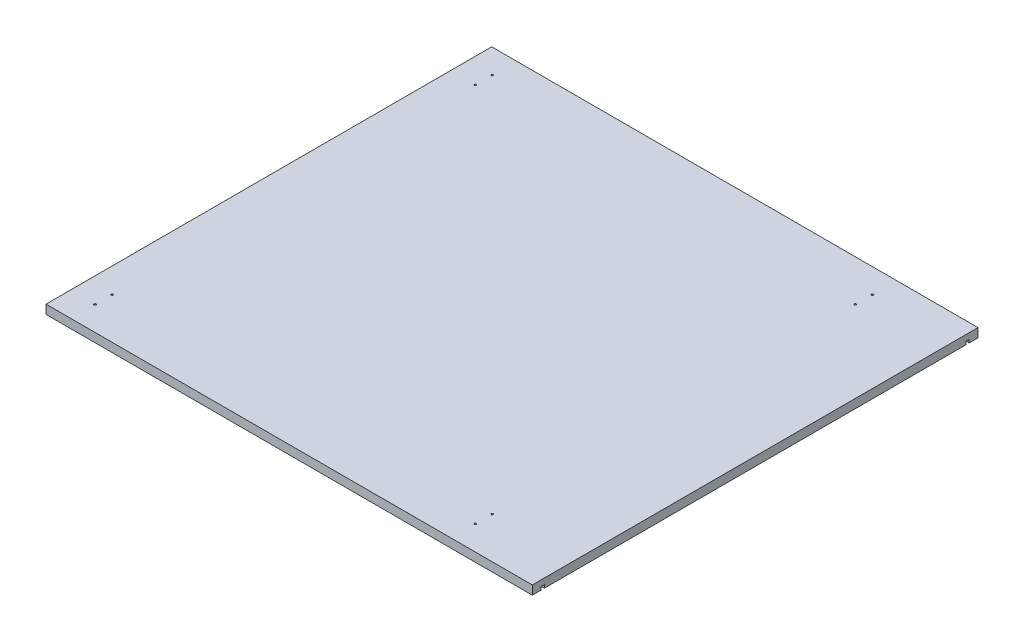
from build123d import *

# Parameters (mm, degrees)
SKETCH1_W           = 997.712
SKETCH1_H           = 914.4
BOSS_EXTRUDE1_DEPTH = 18.25625
SKETCH2_R           = 2
CUT_EXTRUDE1_DEPTH  = 50.8
CUT_EXTRUDE3_DEPTH  = 6.35


with BuildPart() as part:
    # Sketch1 → Boss-Extrude1 (new body)
    with BuildSketch(Plane(origin=(0, 0, 0), x_dir=(1, 0, 0), z_dir=(0, 1, 0))):
        Rectangle(SKETCH1_W, SKETCH1_H)
    extrude(amount=BOSS_EXTRUDE1_DEPTH)

    # Sketch2 → Cut-Extrude1 (cut)
    with BuildSketch(Plane(origin=(0, 18.25625, 0), x_dir=(1, 0, 0), z_dir=(0, 1, 0))):
        with Locations(Location((-448.056, 407.5, 0), (0, 0, 270))):
            Circle(SKETCH2_R)
        with Locations(Location((-448.056, 372.5, 0), (0, 0, 270))):
            Circle(SKETCH2_R)
        with Locations(Location((331.944, 372.5, 0), (0, 0, 270))):
            Circle(SKETCH2_R)
        with Locations(Location((331.944, 407.5, 0), (0, 0, 270))):
            Circle(SKETCH2_R)
        with Locations(Location((-448.056, -372.5, 0), (0, 0, 270))):
            Circle(SKETCH2_R)
        with Locations(Location((-448.056, -407.5, 0), (0, 0, 270))):
            Circle(SKETCH2_R)
        with Locations(Location((331.944, -372.5, 0), (0, 0, 270))):
            Circle(SKETCH2_R)
        with Locations(Location((331.944, -407.5, 0), (0, 0, 270))):
            Circle(SKETCH2_R)
    extrude(amount=-CUT_EXTRUDE1_DEPTH, mode=Mode.SUBTRACT)

    # Sketch4 → Cut-Extrude3 (cut)
    with BuildSketch(Plane.XZ):
        Polygon((-480.59975, -438.94375), (498.856, -438.94375), (498.856, -432.59375), (-474.24975, -432.59375), (-474.24975, 432.59375), (498.856, 432.59375), (498.856, 438.94375), (-480.59975, 438.94375), align=None)
    extrude(amount=-CUT_EXTRUDE3_DEPTH, mode=Mode.SUBTRACT)


solid = part.part
